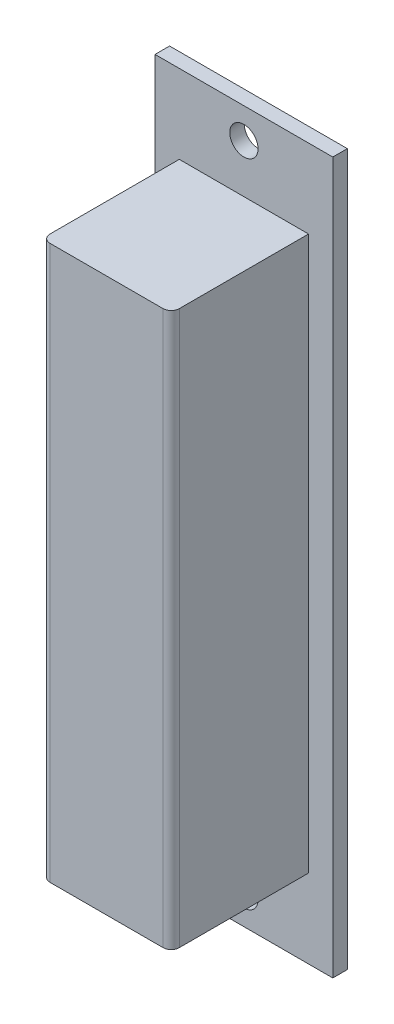
from build123d import *

# Parameters (mm, degrees)
SKETCH_1_W      = 22
SKETCH_1_H      = 88
SKETCH_1_R      = 1.75
EXTRUDE_1_DEPTH = 1.8
SKETCH_2_W      = 16
SKETCH_2_H      = 68.5
EXTRUDE_2_DEPTH = 17
FILLET_1_R      = 1


with BuildPart() as part:
    # 草图1 → 拉伸1 (new body)
    with BuildSketch(Plane.XY):
        Rectangle(SKETCH_1_W, SKETCH_1_H)
        with Locations((0, 40.25)):
            Circle(SKETCH_1_R, mode=Mode.SUBTRACT)
        with Locations(Location((0, -40.25, 0), (0, 0, 180))):
            Circle(SKETCH_1_R, mode=Mode.SUBTRACT)
    extrude(amount=EXTRUDE_1_DEPTH)

    # 草图2 → 拉伸2 (add)
    with BuildSketch(Plane.XY.offset(1.8)):
        Rectangle(SKETCH_2_W, SKETCH_2_H)
    extrude(amount=EXTRUDE_2_DEPTH)

    # 圆角1
    fillet_1_edges = [part.edges().sort_by_distance(p)[0] for p in [
        (-8, 0, 18.8),
        (8, 0, 18.8),
    ]]
    fillet(fillet_1_edges, radius=FILLET_1_R)


solid = part.part
